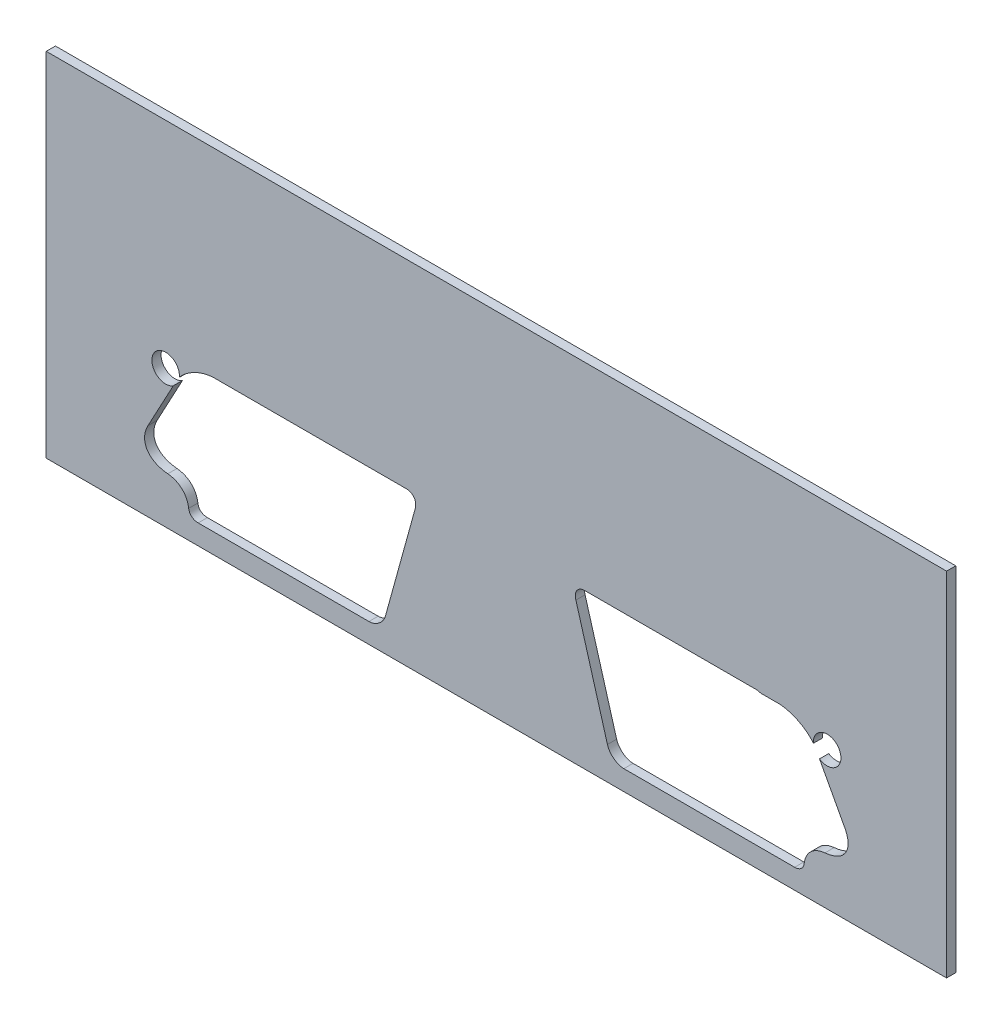
from build123d import *

# Parameters (mm, degrees)
EXTRUDE_1_DEPTH     = 1
CUT_EXTRUDE_4_DEPTH = 54.935146241
SKETCH_4_R          = 1.5
CUT_EXTRUDE_5_DEPTH = 54.935146241
CUT_EXTRUDE1_START  = -1
CUT_EXTRUDE1_DEPTH  = 1


with BuildPart() as part:
    # Эскиз1 → Бобышка-Вытянуть1 (new body)
    with BuildSketch(Plane.XY):
        Polygon((-49, 5.839183832), (-49, -22.516660498), (49, -22.516660498), (49, 5.839183832), (49, 15.839183832), (-49, 15.839183832), align=None)
    extrude(amount=EXTRUDE_1_DEPTH)

    # Эскиз2 → Вырез-Вытянуть4 (cut, through all)
    with BuildSketch(Plane(origin=(0, 0, 0), x_dir=(-1, 0, 0), z_dir=(0, 0, -1))):
        with BuildLine():
            Line((27.226146034, -9.122134253), (15.739905482, -9.122134253))
            ThreePointArc((15.739905482, -9.122134253), (15.10500819, -9.461530461), (14.917793913, -10.156681647))
            Line((14.917793913, -10.156681647), (17.442090319, -18.930924047))
            ThreePointArc((17.442090319, -18.930924047), (18.050493328, -19.909298147), (19.122649731, -20.331021695))
            Line((19.122649731, -20.331021695), (30.826843589, -20.331021695))
            ThreePointArc((30.826843589, -20.331021695), (31.459345435, -19.990005133), (31.64325008, -19.295361367))
            Line((31.64325008, -19.295361367), (29.100959308, -10.488607797))
            ThreePointArc((29.100959308, -10.488607797), (28.40806584, -9.469896887), (27.226146034, -9.122134253))
        make_face()
        with BuildLine():
            Line((-31.64325008, -19.295361367), (-29.100959308, -10.488607797))
            ThreePointArc((-29.100959308, -10.488607797), (-28.40806584, -9.469896887), (-27.226146034, -9.122134253))
            Line((-27.226146034, -9.122134253), (-15.739905482, -9.122134253))
            ThreePointArc((-15.739905482, -9.122134253), (-15.10500819, -9.461530461), (-14.917793913, -10.156681647))
            Line((-14.917793913, -10.156681647), (-17.442090319, -18.930924047))
            ThreePointArc((-17.442090319, -18.930924047), (-18.050493328, -19.909298147), (-19.122649731, -20.331021695))
            Line((-19.122649731, -20.331021695), (-30.826843589, -20.331021695))
            ThreePointArc((-30.826843589, -20.331021695), (-31.459345435, -19.990005133), (-31.64325008, -19.295361367))
        make_face()
    extrude(amount=-CUT_EXTRUDE_4_DEPTH, mode=Mode.SUBTRACT)

    # Эскиз4 → Вырез-Вытянуть5 (cut, through all)
    with BuildSketch(Plane(origin=(0, 0, 0), x_dir=(-1, 0, 0), z_dir=(0, 0, -1))):
        with Locations((36, -7.524952718)):
            Circle(SKETCH_4_R)
        with Locations((-36, -7.524952718)):
            Circle(SKETCH_4_R)
    extrude(amount=-CUT_EXTRUDE_5_DEPTH, mode=Mode.SUBTRACT)

    # Sketch3 → Cut-Extrude1 (cut)
    with BuildSketch(Plane.XY.offset(1).offset(CUT_EXTRUDE1_START)):
        with BuildLine():
            Line((8.652344227, -7.068131311), (12.085677561, -18.961546856))
            add(Edge.make_bspline(
                [(12.085677561, -18.961546856), (12.485677561, -20.347187502), (13.871318207, -20.347187502)],
                knots=[0.857071948, 0.857071948, 0.857071948, 2.427868275, 2.427868275, 2.427868275], degree=2, weights=[1, 0.707106781, 1]))
            Line((13.871318207, -20.347187502), (32.461996875, -20.347187502))
            add(Edge.make_bspline(
                [(32.461996875, -20.347187502), (33.393769403, -20.347187502), (33.496157418, -19.484255682)],
                knots=[2.427868275, 2.427868275, 2.427868275, 3.611858299, 3.611858299, 3.611858299], degree=2, weights=[1, 0.829829079, 1]))
            add(Edge.make_bspline(
                [(33.496157418, -19.484255682), (33.529743577, -19.201189685), (33.607326061, -18.923570429), (33.853252735, -18.417152493), (34.025349409, -18.183932413), (34.436238564, -17.8036127), (34.681879478, -17.649935655), (35.200024528, -17.435065661), (35.479061866, -17.369439067), (35.76148791, -17.34207634)],
                knots=[0, 0, 0, 0, 0.25, 0.25, 0.5, 0.5, 0.75, 0.75, 1, 1, 1, 1], degree=3))
            add(Edge.make_bspline(
                [(35.76148791, -17.34207634), (36.181169226, -17.301415694), (36.592378309, -17.212108423), (37.170380488, -16.959028015), (37.354968395, -16.854344533), (37.687544868, -16.599797528), (37.83830967, -16.446579579), (38.076557482, -16.101495837), (38.166209489, -15.905573827), (38.271501218, -15.499696694), (38.288800836, -15.285469364), (38.263278752, -14.867475934), (38.220734772, -14.657932914), (38.094284502, -14.258193956), (38.010543981, -14.065974434), (37.910619322, -13.879789794)],
                knots=[0, 0, 0, 0, 0.25, 0.25, 0.375, 0.375, 0.5, 0.5, 0.625, 0.625, 0.75, 0.75, 0.875, 0.875, 1, 1, 1, 1], degree=3))
            Line((37.910619322, -13.879789794), (35.170885606, -8.774980446))
            ThreePointArc((35.170885606, -8.774980446), (34.803783463, -8.429975368), (34.571610551, -7.982886756))
            ThreePointArc((34.571610551, -7.982886756), (34.527886571, -7.812845152), (34.504331156, -7.638859302))
            add(Edge.make_bspline(
                [(34.504331156, -7.638859302), (33.03670289, -5.782259548), (30.630891119, -5.783194379)],
                knots=[4.00651056, 4.00651056, 4.00651056, 5.38030343, 5.38030343, 5.38030343], degree=2, weights=[1, 0.773217832, 1]))
            Line((30.630891119, -5.783194379), (28.778313515, -5.783914238))
            add(Edge.make_bspline(
                [(28.778313515, -5.783914238), (28.498733332, -5.682490665), (28.228663541, -5.682490665)],
                knots=[5.18447533, 5.18447533, 5.18447533, 5.569460928, 5.569460928, 5.569460928], degree=2, weights=[1, 0.981530397, 1]))
            Line((28.228663541, -5.682490665), (9.637984874, -5.682490665))
            add(Edge.make_bspline(
                [(9.637984874, -5.682490665), (8.252344227, -5.682490665), (8.652344227, -7.068131311)],
                knots=[5.569460928, 5.569460928, 5.569460928, 7.140257255, 7.140257255, 7.140257255], degree=2, weights=[1, 0.707106781, 1]))
        make_face()
        with BuildLine():
            Line((-35.170885606, -8.774980446), (-37.925052204, -13.906681863))
            add(Edge.make_bspline(
                [(-37.925052204, -13.906681863), (-38.025225081, -14.093328995), (-38.109806595, -14.28778394), (-38.235924368, -14.687324932), (-38.278394681, -14.895918794), (-38.297414091, -15.212202185), (-38.296322734, -15.317469634), (-38.277441195, -15.527644209), (-38.259343447, -15.633280004), (-38.205994928, -15.836909506), (-38.170798519, -15.935630825), (-38.082894213, -16.126717018), (-38.029532599, -16.219817403), (-37.849055501, -16.479499021), (-37.698892817, -16.631115336), (-37.362837335, -16.886481906), (-37.179664999, -16.989484869), (-36.595923377, -17.242719775), (-36.186794345, -17.329699001), (-35.766265682, -17.369273893)],
                knots=[0, 0, 0, 0, 0.125, 0.125, 0.25, 0.25, 0.3125, 0.3125, 0.375, 0.375, 0.4375, 0.4375, 0.5, 0.5, 0.625, 0.625, 0.75, 0.75, 1, 1, 1, 1], degree=3))
            add(Edge.make_bspline(
                [(-33.495182661, -19.492227082), (-33.738478544, -17.560103824), (-35.766265682, -17.369273893)],
                knots=[5.81913938, 5.81913938, 5.81913938, 6.905546226, 6.905546226, 6.905546226], degree=2, weights=[1, 0.856057288, 1]))
            add(Edge.make_bspline(
                [(-33.495182661, -19.492227082), (-33.387524752, -20.347187502), (-32.461996875, -20.347187502)],
                knots=[2.677546726, 2.677546726, 2.677546726, 3.855317033, 3.855317033, 3.855317033], degree=2, weights=[1, 0.83156042, 1]))
            Line((-32.461996875, -20.347187502), (-13.871318207, -20.347187502))
            add(Edge.make_bspline(
                [(-13.871318207, -20.347187502), (-12.46794332, -20.347187502), (-12.080702928, -18.943926093)],
                knots=[3.855317033, 3.855317033, 3.855317033, 5.438830393, 5.438830393, 5.438830393], degree=2, weights=[1, 0.702596367, 1]))
            Line((-12.080702928, -18.943926093), (-8.83075434, -7.166932971))
            add(Edge.make_bspline(
                [(-8.83075434, -7.166932971), (-8.45309236, -5.798381309), (-9.82190813, -5.798913193)],
                knots=[5.438830393, 5.438830393, 5.438830393, 6.997298301, 6.997298301, 6.997298301], degree=2, weights=[1, 0.711452073, 1]))
            Line((-9.82190813, -5.798913193), (-30.645016113, -5.807004464))
            add(Edge.make_bspline(
                [(-30.645016113, -5.807004464), (-33.032902471, -5.807932329), (-34.505069218, -7.648167801)],
                knots=[0.90305787, 0.90305787, 0.90305787, 2.269113721, 2.269113721, 2.269113721], degree=2, weights=[1, 0.775665219, 1]))
            ThreePointArc((-34.505069218, -7.648167801), (-34.53118454, -7.829224215), (-34.579145022, -8.005755309))
            ThreePointArc((-34.579145022, -8.005755309), (-34.811085633, -8.43954696), (-35.170885606, -8.774980446))
        make_face()
    extrude(amount=CUT_EXTRUDE1_DEPTH, mode=Mode.SUBTRACT)


solid = part.part
